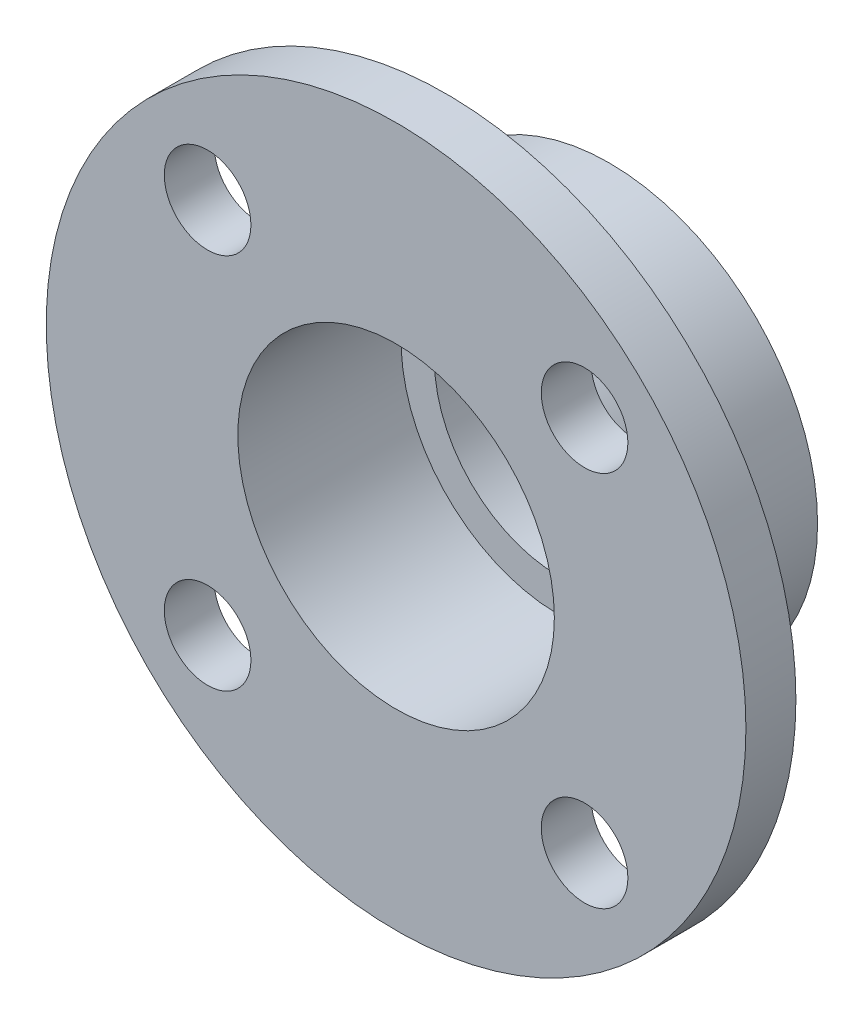
from build123d import *

# Parameters (mm, degrees)
SKETCH_2_R               = 2.6
CUT_EXTRUDE_1_DEPTH      = 3
PATTERN_CIRCULAR_1_COUNT = 4


with BuildPart() as part:
    # Эскиз1 → Повернуть1 (revolve)
    with BuildSketch(Plane(origin=(0, 0, 0), x_dir=(1, 0, 0), z_dir=(0, 1, 0)), mode=Mode.PRIVATE) as revolve_1_sk:
        Polygon((-9.5, 0), (-21, 0), (-21, 3), (-12.5, 3), (-12.5, 12.8), (-7.5, 12.8), (-7.5, 9.8), (-9.5, 9.8), align=None)
    revolve(revolve_1_sk.sketch.rotate(Axis((0, 0, 0), (0, 0, -1)), 180), axis=Axis((0, 0, 0), (0, 0, -1)))

    # Эскиз2 → Вырез-Вытянуть1 (cut)
    with BuildSketch(Plane.XY):
        with Locations((11.313708499, 11.313708499)):
            Circle(SKETCH_2_R)
    cut_extrude_1 = extrude(amount=-CUT_EXTRUDE_1_DEPTH, mode=Mode.SUBTRACT)

    # Круговой массив1: Вырез-Вытянуть1 ×4 about axis
    pattern_circular_1_axis = Axis((0, 0, 0), (0, 0, 1))
    for i in range(1, PATTERN_CIRCULAR_1_COUNT):
        add(cut_extrude_1.rotate(pattern_circular_1_axis, i * 360 / PATTERN_CIRCULAR_1_COUNT), mode=Mode.SUBTRACT)


solid = part.part
